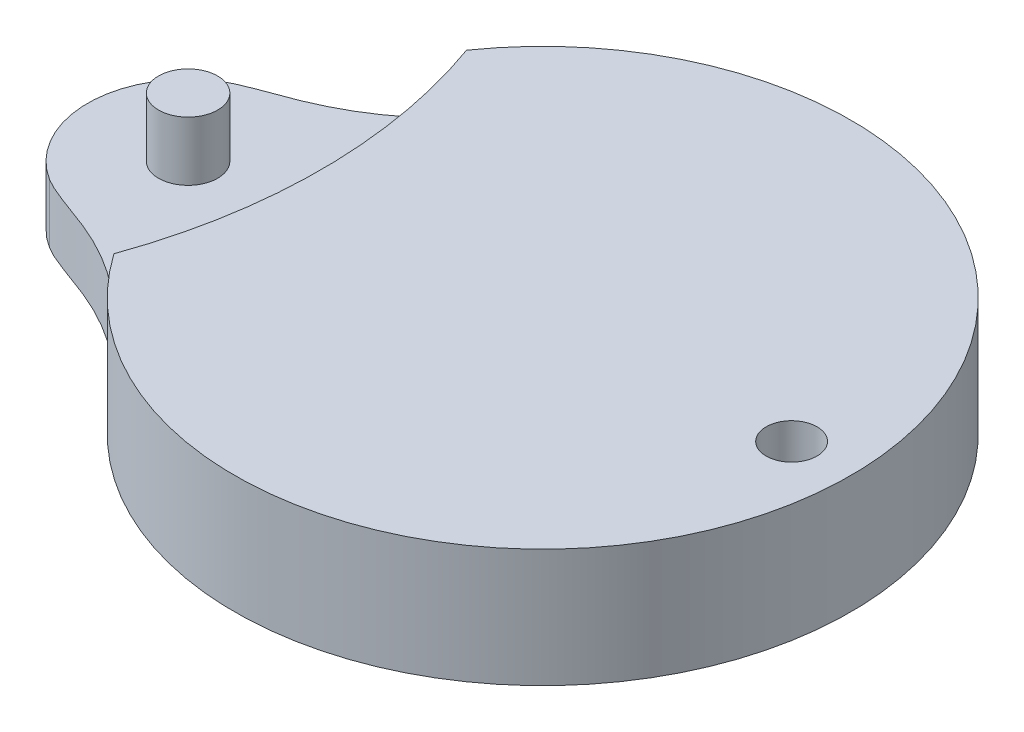
from build123d import *

# Parameters (mm, degrees)
SKETCH2_R           = 2.15
BOSS_EXTRUDE2_DEPTH = 5
SKETCH2_4_R         = 2.5
BOSS_EXTRUDE3_DEPTH = 10
SKETCH2_5_R         = 2.15
CUT_EXTRUDE1_DEPTH  = 10


with BuildPart() as part:
    # Sketch2 → Boss-Extrude2 (new body)
    with BuildSketch(Plane(origin=(0, 0, 0), x_dir=(1, 0, 0), z_dir=(0, 1, 0))):
        with BuildLine():
            ThreePointArc((41.396346652, -14.911153002), (88.805627965, 0), (41.396346652, 14.911153002))
            add(Edge.make_bspline(
                [(41.396346652, 14.911153002), (35.610115035, 8.935267229), (30.816373967, 8.824209594), (28.225205258, 7.191755049)],
                knots=[0.924562573, 0.924562573, 0.924562573, 0.924562573, 1.924562573, 1.924562573, 1.924562573, 1.924562573], degree=3))
            ThreePointArc((28.225205258, 7.191755049), (24.256061614, 0), (28.225205258, -7.191755049))
            add(Edge.make_bspline(
                [(28.225205258, -7.191755049), (30.816373967, -8.824209594), (35.610115035, -8.935267229), (41.396346652, -14.911153002)],
                knots=[0, 0, 0, 0, 1, 1, 1, 1], degree=3))
        make_face()
        with Locations(Location((83.805627965, 0, 0), (0, 0, 270))):
            Circle(SKETCH2_R, mode=Mode.SUBTRACT)
    extrude(amount=BOSS_EXTRUDE2_DEPTH)

    # Sketch2<4> → Boss-Extrude3 (add)
    with BuildSketch(Plane(origin=(0, 0, 0), x_dir=(1, 0, 0), z_dir=(0, 1, 0))):
        with Locations(Location((32.756061614, 0, 0), (0, 0, 270))):
            Circle(SKETCH2_4_R)
        with BuildLine():
            ThreePointArc((41.396346652, 14.911153002), (88.805627965, 0), (41.396346652, -14.911153002))
            ThreePointArc((41.396346652, -14.911153002), (44, 0), (41.396346652, 14.911153002))
        make_face()
    extrude(amount=BOSS_EXTRUDE3_DEPTH)

    # Sketch2<5> → Cut-Extrude1 (cut)
    with BuildSketch(Plane(origin=(0, 0, 0), x_dir=(1, 0, 0), z_dir=(0, 1, 0))):
        with Locations(Location((83.805627965, 0, 0), (0, 0, 90))):
            Circle(SKETCH2_5_R)
    extrude(amount=CUT_EXTRUDE1_DEPTH, mode=Mode.SUBTRACT)


solid = part.part
